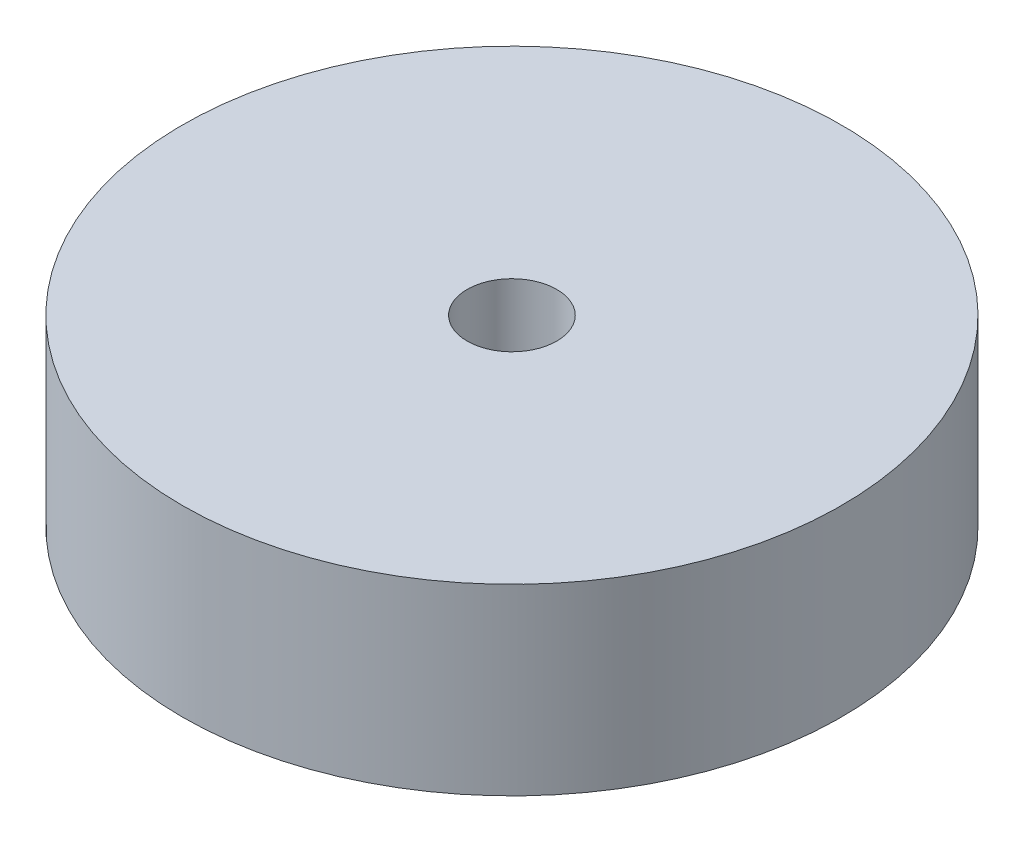
from build123d import *

# Parameters (mm, degrees)
SKETCH3_R           = 36.547496335
BOSS_EXTRUDE1_DEPTH = 20.32
SKETCH4_R           = 4.968719862
CUT_EXTRUDE1_DEPTH  = 34.544


with BuildPart() as part:
    # Sketch3 → Boss-Extrude1 (new body)
    with BuildSketch(Plane(origin=(0, 0, 0), x_dir=(1, 0, 0), z_dir=(0, 1, 0))):
        with Locations(Location((-157.616541965, 28.165155265, 0), (0, 0, 270))):
            Circle(SKETCH3_R)
    extrude(amount=BOSS_EXTRUDE1_DEPTH)

    # Sketch4 → Cut-Extrude1 (cut)
    with BuildSketch(Plane(origin=(0, 20.32, 0), x_dir=(1, 0, 0), z_dir=(0, 1, 0))):
        with Locations(Location((-157.616541965, 28.165155265, 0), (0, 0, 270))):
            Circle(SKETCH4_R)
    extrude(amount=-CUT_EXTRUDE1_DEPTH, mode=Mode.SUBTRACT)


solid = part.part
